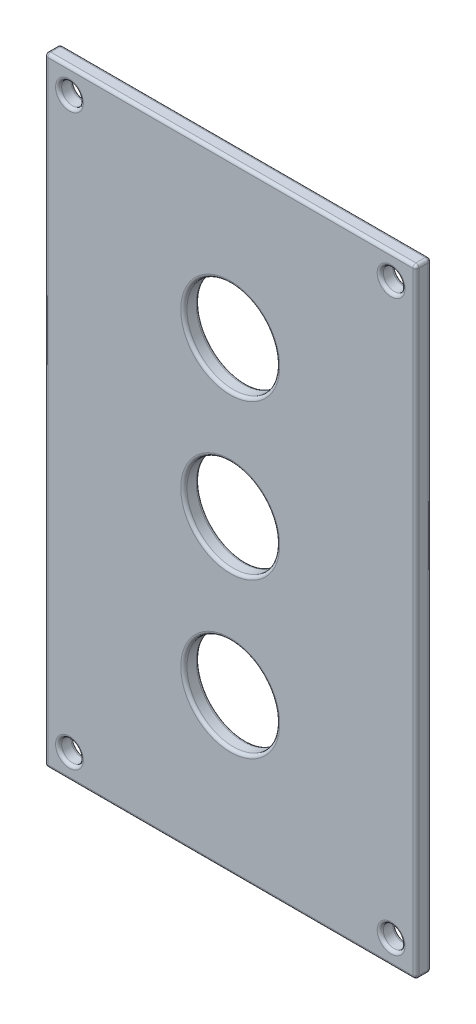
from build123d import *

# Parameters (mm, degrees)
CROQUIS1_W              = 60
CROQUIS1_H              = 100
CROQUIS1_R              = 1.75
SALIENTE_EXTRUIR1_DEPTH = 2.5
CORTAR_EXTRUIR1_REACH   = 118.646
CROQUIS3_R              = 7.5
REDONDEO1_R             = 0.5


with BuildPart() as part:
    # Croquis1 → Saliente-Extruir1 (new body)
    with BuildSketch(Plane.XY):
        with Locations((30, 50)):
            Rectangle(CROQUIS1_W, CROQUIS1_H)
        with Locations((4, 96)):
            Circle(CROQUIS1_R, mode=Mode.SUBTRACT)
        with Locations((4, 4)):
            Circle(CROQUIS1_R, mode=Mode.SUBTRACT)
        with Locations((56, 4)):
            Circle(CROQUIS1_R, mode=Mode.SUBTRACT)
        with Locations((56, 96)):
            Circle(CROQUIS1_R, mode=Mode.SUBTRACT)
    extrude(amount=SALIENTE_EXTRUIR1_DEPTH)

    # Croquis3 → Cortar-Extruir1 (cut, up to next)
    with BuildSketch(Plane.XY.offset(2.5), mode=Mode.PRIVATE) as cortar_extruir1_sk1:
        with Locations((30, 50)):
            Circle(CROQUIS3_R)
    cortar_extruir1_tool1 = extrude(cortar_extruir1_sk1.sketch, amount=-CORTAR_EXTRUIR1_REACH, mode=Mode.PRIVATE) & part.part
    # Croquis3 → Cortar-Extruir1 (cut, up to next)
    with BuildSketch(Plane.XY.offset(2.5), mode=Mode.PRIVATE) as cortar_extruir1_sk2:
        with Locations((30, 75)):
            Circle(CROQUIS3_R)
    cortar_extruir1_tool2 = extrude(cortar_extruir1_sk2.sketch, amount=-CORTAR_EXTRUIR1_REACH, mode=Mode.PRIVATE) & part.part
    # Croquis3 → Cortar-Extruir1 (cut, up to next)
    with BuildSketch(Plane.XY.offset(2.5), mode=Mode.PRIVATE) as cortar_extruir1_sk3:
        with Locations((30, 25)):
            Circle(CROQUIS3_R)
    cortar_extruir1_tool3 = extrude(cortar_extruir1_sk3.sketch, amount=-CORTAR_EXTRUIR1_REACH, mode=Mode.PRIVATE) & part.part
    add(cortar_extruir1_tool1.solids().sort_by_distance((30, 50, 2.5))[0], mode=Mode.SUBTRACT)
    add(cortar_extruir1_tool2.solids().sort_by_distance((30, 75, 2.5))[0], mode=Mode.SUBTRACT)
    add(cortar_extruir1_tool3.solids().sort_by_distance((30, 25, 2.5))[0], mode=Mode.SUBTRACT)

    # Redondeo1
    redondeo1_edges = [part.edges().sort_by_distance(p)[0] for p in [
        (2.25, 96, 0),
        (2.25, 96, 2.5),
        (60, 50, 2.5),
        (2.25, 4, 0),
        (2.25, 4, 2.5),
        (30, 100, 2.5),
        (54.25, 4, 0),
        (54.25, 4, 2.5),
        (54.25, 96, 0),
        (54.25, 96, 2.5),
        (22.5, 25, 0),
        (22.5, 25, 2.5),
        (22.5, 75, 0),
        (22.5, 75, 2.5),
        (22.5, 50, 0),
        (22.5, 50, 2.5),
        (0, 50, 2.5),
        (30, 100, 0),
        (60, 50, 0),
        (30, 0, 0),
        (0, 50, 0),
        (0, 100, 1.25),
        (60, 100, 1.25),
        (60, 0, 1.25),
        (0, 0, 1.25),
        (30, 0, 2.5),
    ]]
    fillet(redondeo1_edges, radius=REDONDEO1_R)


solid = part.part
